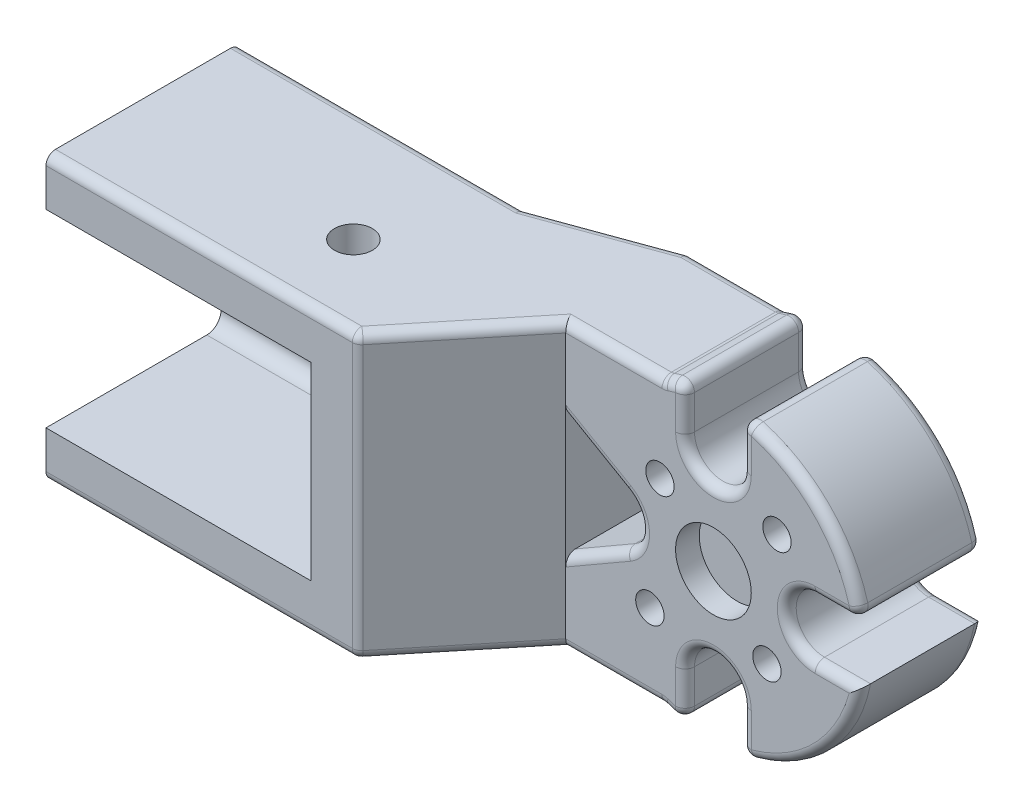
from build123d import *

# Parameters (mm, degrees)
ESQUISSE4_R                   = 1.5
BOSS_EXTRU_3_DEPTH            = 6.5
ENL_V_MAT_EXTRU_7_DEPTH       = 24.18232085
BOSS_EXTRU_7_DEPTH            = 13
BOSS_EXTRU_8_DEPTH            = 30
TROU_TARAUD_M32_D             = 2.5
TROU_TARAUD_M32_DEPTH         = 28.655777755
TROU_TARAUD_M32_CSINK_D       = 3.5
TROU_TARAUD_M32_CSINK_ANGLE   = 90
ENL_V_MAT_EXTRU_1_DEPTH       = 28
ENL_V_MAT_EXTRU_8_DEPTH       = 63.451431526
ESQUISSE13_R                  = 2
ENL_V_MAT_EXTRU_4_DEPTH       = 70.565716434
ESQUISSE15_R                  = 2
ENL_V_MAT_EXTRU_5_DEPTH       = 66.046736448
ENL_V_MAT_EXTRU_6_DEPTH       = 79.827149608
ESQUISSE24_R                  = 4
ENL_V_MAT_EXTRU_9_DEPTH       = 2.5
ENL_V_MAT_EXTRU_11_DEPTH      = 64.270182283
ENL_V_MAT_EXTRU_11_DEPTH_BACK = 64.270182283
ESQUISSE4_6_R                 = 1.5
CONG_1_R                      = 1


with BuildPart() as part:
    # Esquisse4 → Boss.-Extru.3 (new, symmetric)
    with BuildSketch(Plane.XY):
        with BuildLine():
            Line((-10.75, 3), (-13.572398462, 3))
            ThreePointArc((-13.572398462, 3), (-9.828784258, 9.828784258), (-3, 13.572398462))
            Line((-3, 13.572398462), (-3, 10.75))
            ThreePointArc((-3, 10.75), (0, 7.75), (3, 10.75))
            Line((3, 10.75), (3, 13.572398462))
            ThreePointArc((3, 13.572398462), (9.828784258, 9.828784258), (13.572398462, 3))
            Line((13.572398462, 3), (10.75, 3))
            ThreePointArc((10.75, 3), (7.75, 0), (10.75, -3))
            Line((10.75, -3), (13.572398462, -3))
            ThreePointArc((13.572398462, -3), (9.828784258, -9.828784258), (3, -13.572398462))
            Line((3, -13.572398462), (3, -10.75))
            ThreePointArc((3, -10.75), (0, -7.75), (-3, -10.75))
            Line((-3, -10.75), (-3, -13.572398462))
            ThreePointArc((-3, -13.572398462), (-9.828784258, -9.828784258), (-13.572398462, -3))
            Line((-13.572398462, -3), (-10.75, -3))
            ThreePointArc((-10.75, -3), (-7.75, 0), (-10.75, 3))
        make_face()
        with Locations(Location((-6.717514421, -6.717514421, 0), (0, 0, 180))):
            Circle(ESQUISSE4_R, mode=Mode.SUBTRACT)
        with Locations(Location((6.717514421, 6.717514421, 0), (0, 0, 180))):
            Circle(ESQUISSE4_R, mode=Mode.SUBTRACT)
        with Locations(Location((-5.656854249, 5.656854249, 0), (0, 0, 180))):
            Circle(ESQUISSE4_R, mode=Mode.SUBTRACT)
        with Locations(Location((5.656854249, -5.656854249, 0), (0, 0, 180))):
            Circle(ESQUISSE4_R, mode=Mode.SUBTRACT)
    extrude(amount=BOSS_EXTRU_3_DEPTH, both=True)

    # Esquisse20 → Enlèv. mat.-Extru.7 (cut, through all)
    with BuildSketch(Plane.XY.offset(6.5)):
        with BuildLine():
            Line((-9.25, -2.598076211), (-18.719475077, -8.065280196))
            Line((-18.719475077, -8.065280196), (-18.719475077, 8.065280196))
            Line((-18.719475077, 8.065280196), (-9.25, 2.598076211))
            ThreePointArc((-9.25, 2.598076211), (-7.75, 0), (-9.25, -2.598076211))
        make_face()
    extrude(amount=-ENL_V_MAT_EXTRU_7_DEPTH, mode=Mode.SUBTRACT)

    # Esquisse7 → Boss.-Extru.7 (add)
    with BuildSketch(Plane.XY.offset(6.5)):
        with BuildLine():
            Line((13.572398462, 3), (15.614416416, 3))
            ThreePointArc((15.614416416, 3), (11.242997821, 11.242997821), (3, 15.614416416))
            Line((3, 15.614416416), (3, 13.572398462))
            ThreePointArc((3, 13.572398462), (9.828784258, 9.828784258), (13.572398462, 3))
        make_face()
        with BuildLine():
            Line((13.572398462, -3), (15.614416416, -3))
            ThreePointArc((15.614416416, -3), (11.242997821, -11.242997821), (3, -15.614416416))
            Line((3, -15.614416416), (3, -13.572398462))
            ThreePointArc((3, -13.572398462), (9.828784258, -9.828784258), (13.572398462, -3))
        make_face()
        with BuildLine():
            Line((-3, -13.572398462), (-3, -15.614416416))
            ThreePointArc((-3, -15.614416416), (-11.242997821, -11.242997821), (-15.614416416, -3))
            Line((-15.614416416, -3), (-13.572398462, -3))
            ThreePointArc((-13.572398462, -3), (-9.828784258, -9.828784258), (-3, -13.572398462))
        make_face()
        with BuildLine():
            Line((-13.572398462, 3), (-15.614416416, 3))
            ThreePointArc((-15.614416416, 3), (-11.242997821, 11.242997821), (-3, 15.614416416))
            Line((-3, 15.614416416), (-3, 13.572398462))
            ThreePointArc((-3, 13.572398462), (-9.828784258, 9.828784258), (-13.572398462, 3))
        make_face()
    extrude(amount=-BOSS_EXTRU_7_DEPTH)

    # Esquisse6 → Boss.-Extru.8 (add)
    with BuildSketch(Plane(origin=(0, -15, 0), x_dir=(1, 0, 0), z_dir=(0, 1, 0))):
        Polygon((-28.406060666, 1.844222245), (-58.406060666, 1.844222245), (-58.406060666, -22.155777755), (-28.406060666, -22.155777755), (-15.614416416, -6.5), (-9.307208208, -6.5), (-3.341143003, -6.5), (-3.341143003, 6.5), (-9.307208208, 6.5), (-15.614416416, 6.5), align=None)
    extrude(amount=BOSS_EXTRU_8_DEPTH)

    # Trou taraudé M32
    with Locations(Plane(origin=(5.656854249, -5.656854249, -6.5), x_dir=(-1, 0, 0), z_dir=(0, 0, -1))):
        with Locations((0, 0), (-1.060660172, 12.37436867)):
            CounterSinkHole(TROU_TARAUD_M32_D / 2, TROU_TARAUD_M32_CSINK_D / 2, depth=TROU_TARAUD_M32_DEPTH, counter_sink_angle=TROU_TARAUD_M32_CSINK_ANGLE)

    # Esquisse8 → Enlèv. mat.-Extru.1 (cut)
    with BuildSketch(Plane.ZY.offset(58.406060666)):
        with BuildLine():
            Line((18.655777755, 10), (1.655777755, 10))
            ThreePointArc((1.655777755, 10), (0.595117583, 9.560660172), (0.155777755, 8.5))
            Line((0.155777755, 8.5), (0.155777755, -8.5))
            ThreePointArc((0.155777755, -8.5), (0.595117583, -9.560660172), (1.655777755, -10))
            Line((1.655777755, -10), (18.655777755, -10))
            ThreePointArc((18.655777755, -10), (19.716437926, -9.560660172), (20.155777755, -8.5))
            Line((20.155777755, -8.5), (20.155777755, 8.5))
            ThreePointArc((20.155777755, 8.5), (19.716437926, 9.560660172), (18.655777755, 10))
        make_face()
    extrude(amount=-ENL_V_MAT_EXTRU_1_DEPTH, mode=Mode.SUBTRACT)

    # Esquisse22 → Enlèv. mat.-Extru.8 (cut, through all)
    with BuildSketch(Plane.XY.offset(6.5)):
        with BuildLine():
            Line((-9.307208208, -2.631105386), (-9.25, -2.598076211))
            ThreePointArc((-9.25, -2.598076211), (-7.75, 0), (-9.25, 2.598076211))
            Line((-9.25, 2.598076211), (-9.307208208, 2.631105386))
            Line((-9.307208208, 2.631105386), (-15.614416416, 6.272573742))
            Line((-15.614416416, 6.272573742), (-15.614416416, -6.272573742))
            Line((-15.614416416, -6.272573742), (-9.307208208, -2.631105386))
        make_face()
    extrude(amount=-ENL_V_MAT_EXTRU_8_DEPTH, mode=Mode.SUBTRACT)

    # Esquisse13 → Enlèv. mat.-Extru.4 (cut, through all)
    with BuildSketch(Plane.XZ.offset(15)):
        with Locations(Location((-34.406060666, 10.155777755, 0), (0, 0, 270))):
            Circle(ESQUISSE13_R)
    extrude(amount=-ENL_V_MAT_EXTRU_4_DEPTH, mode=Mode.SUBTRACT)

    # Esquisse15 → Enlèv. mat.-Extru.5 (cut, through all)
    with BuildSketch(Plane(origin=(0, 0, -1.844222245), x_dir=(-1, 0, 0), z_dir=(0, 0, -1))):
        with Locations((34.406060666, 0)):
            Circle(ESQUISSE15_R)
    extrude(amount=-ENL_V_MAT_EXTRU_5_DEPTH, mode=Mode.SUBTRACT)

    # Esquisse16 → Enlèv. mat.-Extru.6 (cut, through all)
    with BuildSketch(Plane.ZY.offset(58.406060666)):
        Polygon((18.655777755, 10), (18.655777755, -10), (18.655777755, -15), (22.155777755, -15), (22.155777755, 15), (18.655777755, 15), align=None)
    extrude(amount=-ENL_V_MAT_EXTRU_6_DEPTH, mode=Mode.SUBTRACT)

    # Esquisse24 → Enlèv. mat.-Extru.9 (cut)
    with BuildSketch(Plane.XY.offset(6.5)):
        Circle(ESQUISSE24_R)
    extrude(amount=-ENL_V_MAT_EXTRU_9_DEPTH, mode=Mode.SUBTRACT)

    # Esquisse4<6> → Enlèv. mat.-Extru.11 (cut, two sides: drawn at the far end of the back side and taken through both)
    with BuildSketch(Plane.XY.offset(-ENL_V_MAT_EXTRU_11_DEPTH_BACK)):
        with Locations((-6.717514421, -6.717514421)):
            Circle(ESQUISSE4_6_R)
        with Locations((-5.656854249, 5.656854249)):
            Circle(ESQUISSE4_6_R)
    extrude(amount=ENL_V_MAT_EXTRU_11_DEPTH + ENL_V_MAT_EXTRU_11_DEPTH_BACK, mode=Mode.SUBTRACT)

    # Congé1
    cong_1_edges = [part.edges().sort_by_distance(p)[0] for p in [
        (-3, -13.182208208, 6.5),
        (-4.148150794, 15.349359758, -6.5),
        (-3, 15.614416416, 0),
        (-4.148150794, 15.349359758, 6.5),
        (0, -7.75, 6.5),
        (-3, -15.614416416, 0),
        (11.242997821, -11.242997821, -6.5),
        (3, -15.614416416, 0),
        (11.242997821, -11.242997821, 6.5),
        (11.242997821, 11.242997821, -6.5),
        (3, 15.614416416, 0),
        (15.614416416, 3, 0),
        (11.242997821, 11.242997821, 6.5),
        (-5.273518749, 15, 0),
        (-4.148150794, -15.349359758, 6.5),
        (-4.148150794, -15.349359758, -6.5),
        (-5.273518749, -15, 0),
        (-10.443967582, -15, 6.5),
        (-10.443967582, -15, -6.5),
        (-22.010238541, -15, -4.172111123),
        (-43.406060666, -15, -1.844222245),
        (-10.443967582, 15, 6.5),
        (-10.443967582, 15, -6.5),
        (-22.010238541, 15, -4.172111123),
        (-43.406060666, 15, -1.844222245),
        (0, -7.75, -6.5),
        (-3, -13.182208208, -6.5),
        (-12.432208208, -4.435324977, -6.5),
        (-12.432208208, 4.435324977, 6.5),
        (-7.75, 0, -6.5),
        (-12.432208208, 4.435324977, -6.5),
        (-12.432208208, -4.435324977, 6.5),
        (-7.75, 0, 6.5),
        (-3, 13.182208208, -6.5),
        (0, 7.75, -6.5),
        (3, 13.182208208, -6.5),
        (3, -13.182208208, 6.5),
        (-20.580390865, 15, 12.577888877),
        (-20.580390865, -15, 12.577888877),
        (-41.97621299, 15, 18.655777755),
        (13.182208208, 3, -6.5),
        (-25.546365314, 0, 18.655777755),
        (-41.97621299, -15, 18.655777755),
        (7.75, 0, -6.5),
        (13.182208208, -3, -6.5),
        (3, -13.182208208, -6.5),
        (13.182208208, -3, 6.5),
        (7.75, 0, 6.5),
        (13.182208208, 3, 6.5),
        (3, 13.182208208, 6.5),
        (0, 7.75, 6.5),
        (-3, 13.182208208, 6.5),
    ]]
    fillet(cong_1_edges, radius=CONG_1_R)


solid = part.part
